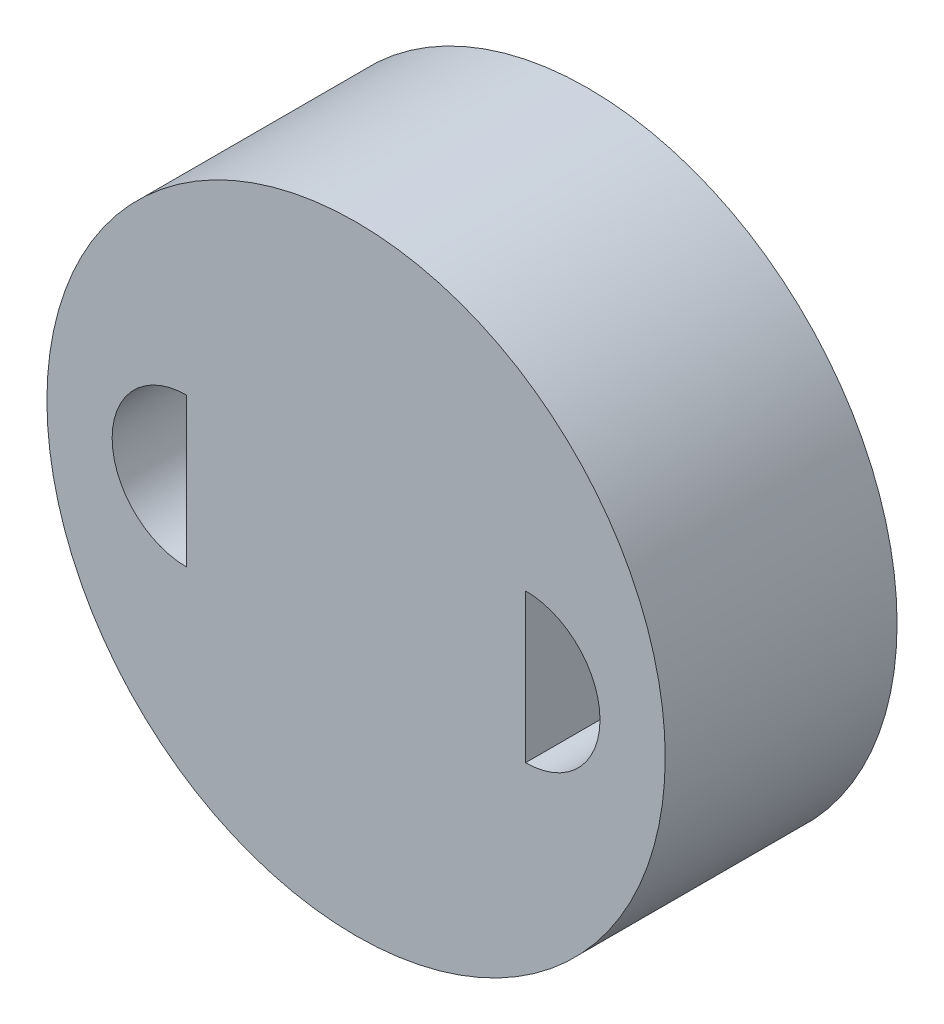
from build123d import *

# Parameters (mm, degrees)
SKETCH1_R               = 101.6
BOSS_EXTRUDE1_DEPTH     = 76.2
CUT_EXTRUDE7_DEPTH      = 163.639355631
CUT_EXTRUDE7_DEPTH_BACK = 163.639355631


with BuildPart() as part:
    # Sketch1 → Boss-Extrude1 (new body)
    with BuildSketch(Plane.XY):
        with Locations(Location((0, 0, 0), (0, 0, 180))):
            Circle(SKETCH1_R)
    extrude(amount=BOSS_EXTRUDE1_DEPTH)

    # Sketch2 → Cut-Extrude7 (cut, two sides: drawn at the far end of the back side and taken through both)
    with BuildSketch(Plane.XY.offset(76.2).offset(-CUT_EXTRUDE7_DEPTH_BACK)):
        with BuildLine():
            ThreePointArc((-55.703026842, -24.462175809), (-80.165202651, 0), (-55.703026842, 24.462175809))
            Line((-55.703026842, 24.462175809), (-55.703026842, -24.462175809))
        make_face()
        with BuildLine():
            Line((55.703026842, 24.462175809), (55.703026842, -24.462175809))
            ThreePointArc((55.703026842, -24.462175809), (80.165202651, 0), (55.703026842, 24.462175809))
        make_face()
    extrude(amount=CUT_EXTRUDE7_DEPTH + CUT_EXTRUDE7_DEPTH_BACK, mode=Mode.SUBTRACT)


solid = part.part
